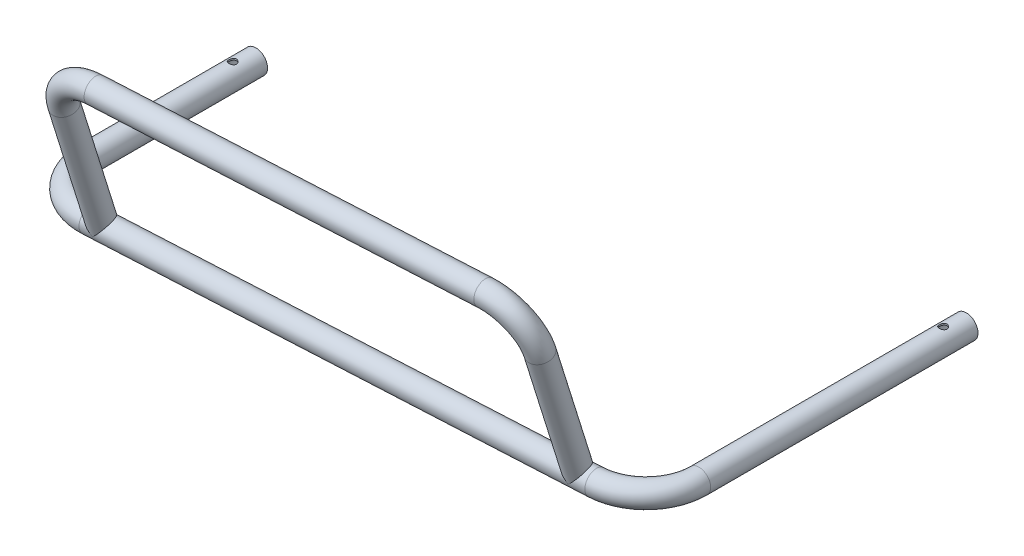
from build123d import *

# Parameters (mm, degrees)
SKETCH21_R                           = 10.033
SKETCH21_R_2                         = 8.763
CHASSIS_BUMPERFRAMEPROFILE_1_DEPTH   = 230
SKETCH21_ON_SEGMENT_2_R              = 10.033
SKETCH21_ON_SEGMENT_2_R_2            = 8.763
CHASSIS_BUMPERFRAMEPROFILE_1_2_ANGLE = 87
SKETCH21_ON_SEGMENT_3_R              = 10.033
SKETCH21_ON_SEGMENT_3_R_2            = 8.763
CHASSIS_BUMPERFRAMEPROFILE_1_3_DEPTH = 414
SKETCH21_ON_SEGMENT_4_R              = 10.033
SKETCH21_ON_SEGMENT_4_R_2            = 8.763
CHASSIS_BUMPERFRAMEPROFILE_1_4_ANGLE = 93
SKETCH21_ON_SEGMENT_5_R              = 10.033
SKETCH21_ON_SEGMENT_5_R_2            = 8.763
CHASSIS_BUMPERFRAMEPROFILE_1_5_DEPTH = 145
SKETCH2_R                            = 10.033
SKETCH2_R_2                          = 8.763
CHASSIS_BUMPERFRAMEPROFILE_3_DEPTH   = 114.554
SKETCH2_ON_SEGMENT_2_R               = 10.033
SKETCH2_ON_SEGMENT_2_R_2             = 8.763
CHASSIS_BUMPERFRAMEPROFILE_3_2_ANGLE = 90
SKETCH2_ON_SEGMENT_3_R               = 10.033
SKETCH2_ON_SEGMENT_3_R_2             = 8.763
CHASSIS_BUMPERFRAMEPROFILE_3_3_DEPTH = 319.024
SKETCH2_ON_SEGMENT_4_R               = 10.033
SKETCH2_ON_SEGMENT_4_R_2             = 8.763
CHASSIS_BUMPERFRAMEPROFILE_3_4_ANGLE = 90
SKETCH2_ON_SEGMENT_5_R               = 10.033
SKETCH2_ON_SEGMENT_5_R_2             = 8.763
CHASSIS_BUMPERFRAMEPROFILE_3_5_DEPTH = 114.554
CUT_EXTRUDE1_DEPTH                   = 641.192877482
CUT_EXTRUDE1_DEPTH_BACK              = 641.192877482
SKETCH22_R                           = 3.3


with BuildPart() as part:
    # Sketch21 → Chassis BUMPERFRAMEPROFILE(1) (new body)
    with BuildSketch(Plane.XY):
        Circle(SKETCH21_R)
        Circle(SKETCH21_R_2, mode=Mode.SUBTRACT)
    extrude(amount=CHASSIS_BUMPERFRAMEPROFILE_1_DEPTH)


with BuildPart() as body_2:
    # Sketch21 on segment 2 (carried to the start of arc 2) → Chassis BUMPERFRAMEPROFILE_1 2 (revolve)
    with BuildSketch(Plane.XY.offset(230)):
        Circle(SKETCH21_ON_SEGMENT_2_R)
        Circle(SKETCH21_ON_SEGMENT_2_R_2, mode=Mode.SUBTRACT)
    revolve(axis=Axis((-45.586880059, 0, 230), (0, -1, 0)), revolution_arc=CHASSIS_BUMPERFRAMEPROFILE_1_2_ANGLE)


with BuildPart() as body_3:
    # Sketch21 on segment 3 (carried to segment 3) → Chassis BUMPERFRAMEPROFILE_1 3 (new body)
    with BuildSketch(Plane(origin=(-43.201047099, 0, 275.524404825), x_dir=(0.052335956, 0, 0.998629535), z_dir=(-0.998629535, 0, 0.052335956))):
        Circle(SKETCH21_ON_SEGMENT_3_R)
        Circle(SKETCH21_ON_SEGMENT_3_R_2, mode=Mode.SUBTRACT)
    extrude(amount=CHASSIS_BUMPERFRAMEPROFILE_1_3_DEPTH)


with BuildPart() as body_4:
    # Sketch21 on segment 4 (carried to the start of arc 4) → Chassis BUMPERFRAMEPROFILE_1 4 (revolve)
    with BuildSketch(Plane(origin=(-456.633674488, 0, 297.191490709), x_dir=(0.052335956, 0, 0.998629535), z_dir=(-0.998629535, 0, 0.052335956))):
        Circle(SKETCH21_ON_SEGMENT_4_R)
        Circle(SKETCH21_ON_SEGMENT_4_R_2, mode=Mode.SUBTRACT)
    revolve(axis=Axis((-458.939616776, 0, 253.191490709), (0, -1, 0)), revolution_arc=CHASSIS_BUMPERFRAMEPROFILE_1_4_ANGLE)


with BuildPart() as body_5:
    # Sketch21 on segment 5 (carried to segment 5) → Chassis BUMPERFRAMEPROFILE_1 5 (new body)
    with BuildSketch(Plane(origin=(-503, 0, 108.191490709), x_dir=(1, 0, 0), z_dir=(0, 0, 1))):
        Circle(SKETCH21_ON_SEGMENT_5_R)
        Circle(SKETCH21_ON_SEGMENT_5_R_2, mode=Mode.SUBTRACT)
    extrude(amount=CHASSIS_BUMPERFRAMEPROFILE_1_5_DEPTH)


with BuildPart() as part_1:
    add(part.part)

    # Chassis BUMPERFRAMEPROFILE(1) as one body: union body 2, body 3, body 4, body 5
    add(body_2.part)
    add(body_3.part)
    add(body_4.part)
    add(body_5.part)

    # Sketch22 → Cut-Extrude1 (cut, two sides: drawn at the far end of the back side and taken through both)
    with BuildSketch(Plane(origin=(0, 0, 0), x_dir=(1, 0, 0), z_dir=(0, 1, 0)).offset(-CUT_EXTRUDE1_DEPTH_BACK)):
        with Locations(Location((-503, -128.191490709, 0), (0, 0, 270))):
            Circle(SKETCH22_R)
        with Locations(Location((0, -20, 0), (0, 0, 270))):
            Circle(SKETCH22_R)
    extrude(amount=CUT_EXTRUDE1_DEPTH + CUT_EXTRUDE1_DEPTH_BACK, mode=Mode.SUBTRACT)


with BuildPart() as body_2_2:
    # Sketch2 → Chassis BUMPERFRAMEPROFILE(3) (new body)
    with BuildSketch(Plane(origin=(-57, 0, 276.247577302), x_dir=(0.9997996400299483, -0.011764573523751414, -0.016194894435910545), z_dir=(0.01619489443591055, 0.9509186203780452, 0.30901699437494556))):
        Circle(SKETCH2_R)
        Circle(SKETCH2_R_2, mode=Mode.SUBTRACT)
    extrude(amount=CHASSIS_BUMPERFRAMEPROFILE_3_DEPTH)


with BuildPart() as body_3_2:
    # Sketch2 on segment 2 (carried to the start of arc 2) → Chassis BUMPERFRAMEPROFILE_3 2 (revolve)
    with BuildSketch(Plane(origin=(-55.144810063, 108.931531639, 311.646710076), x_dir=(0.99979964, -0.011764574, -0.016194894), z_dir=(0.016194894, 0.95091862, 0.309016994))):
        Circle(SKETCH2_ON_SEGMENT_2_R)
        Circle(SKETCH2_ON_SEGMENT_2_R_2, mode=Mode.SUBTRACT)
    revolve(axis=Axis((-90.351415715, 108.931531639, 313.491810094), (0.049767235, -0.309441073, 0.949615419)), revolution_arc=CHASSIS_BUMPERFRAMEPROFILE_3_2_ANGLE)


with BuildPart() as body_4_2:
    # Sketch2 on segment 3 (carried to segment 3) → Chassis BUMPERFRAMEPROFILE_3 3 (new body)
    with BuildSketch(Plane(origin=(-89.780465986, 142.45609276, 324.38617991), x_dir=(0.018075276, 0.938466556, 0.344896807), z_dir=(-0.998629535, 0, 0.052335956))):
        Circle(SKETCH2_ON_SEGMENT_3_R)
        Circle(SKETCH2_ON_SEGMENT_3_R_2, mode=Mode.SUBTRACT)
    extrude(amount=CHASSIS_BUMPERFRAMEPROFILE_3_3_DEPTH)


with BuildPart() as body_5_2:
    # Sketch2 on segment 4 (carried to the start of arc 4) → Chassis BUMPERFRAMEPROFILE_3 4 (revolve)
    with BuildSketch(Plane(origin=(-444.144810063, 108.931531639, 332.033336217), x_dir=(0.99979964, -0.011764574, -0.016194894), z_dir=(0.016194894, 0.95091862, 0.309016994))):
        Circle(SKETCH2_ON_SEGMENT_4_R)
        Circle(SKETCH2_ON_SEGMENT_4_R_2, mode=Mode.SUBTRACT)
    revolve(axis=Axis((-408.938204411, 108.931531639, 330.188236199), (-0.049767235, 0.309441073, -0.949615419)), revolution_arc=CHASSIS_BUMPERFRAMEPROFILE_3_4_ANGLE)


with BuildPart() as body_6:
    # Sketch2 on segment 5 (carried to segment 5) → Chassis BUMPERFRAMEPROFILE_3 5 (new body)
    with BuildSketch(Plane(origin=(-446, 0, 296.634203444), x_dir=(0.99979964, -0.011764574, -0.016194894), z_dir=(0.016194894, 0.95091862, 0.309016994))):
        Circle(SKETCH2_ON_SEGMENT_5_R)
        Circle(SKETCH2_ON_SEGMENT_5_R_2, mode=Mode.SUBTRACT)
    extrude(amount=CHASSIS_BUMPERFRAMEPROFILE_3_5_DEPTH)


with BuildPart() as body_2_2_1:
    add(body_2_2.part)

    # Chassis BUMPERFRAMEPROFILE(3) as one body: union body 3 2, body 4 2, body 5 2, body 6
    add(body_3_2.part)
    add(body_4_2.part)
    add(body_5_2.part)
    add(body_6.part)


solid = Compound([part_1.part, body_2_2_1.part])
